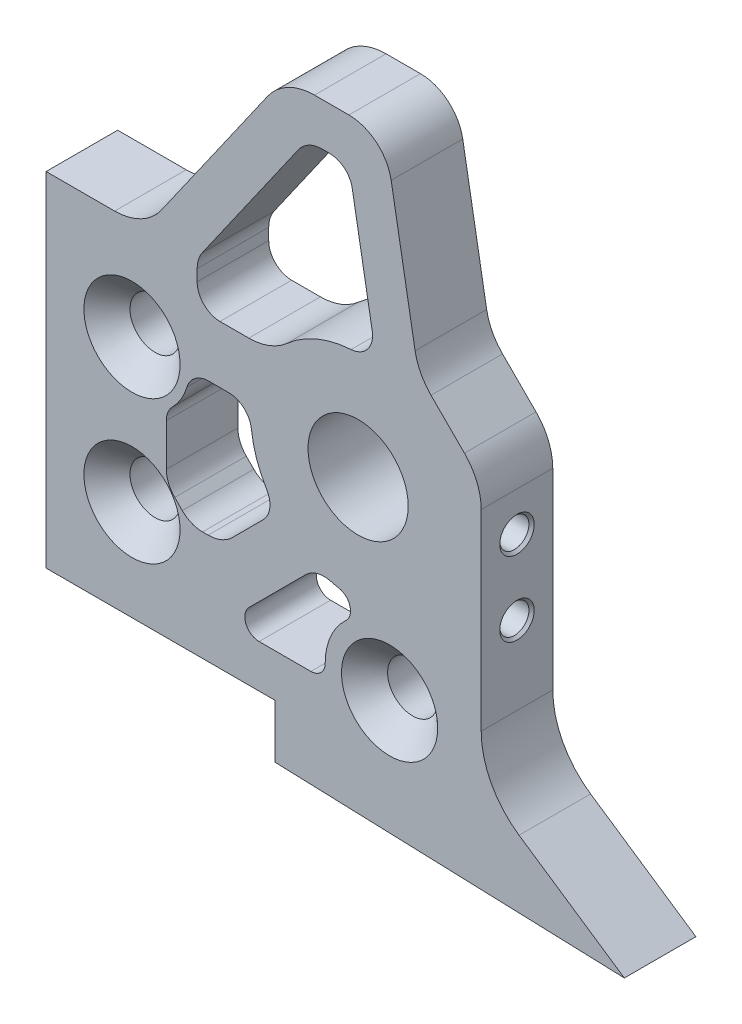
from build123d import *

# Parameters (mm, degrees)
ESBO_O1_R                                           = 17.5
RESSALTO_EXTRUS_O1_DEPTH                            = 25
FILETE1_R                                           = 20
FILETE3_R                                           = 15
CORTE_EXTRUS_O1_DEPTH                               = 156.467038307
ESCAREADO_PARA_PARAFUSO_ALLEN_SEXTAVADO_D           = 17.5
ESCAREADO_PARA_PARAFUSO_ALLEN_SEXTAVADO_CSINK_D     = 33.6
ESCAREADO_PARA_PARAFUSO_ALLEN_SEXTAVADO_CSINK_ANGLE = 90
FURO_ROSCADO_DE_M121_D                              = 10.2
FURO_ROSCADO_DE_M121_DEPTH                          = 25
FURO_ROSCADO_DE_M121_CSINK_D                        = 12.05
FURO_ROSCADO_DE_M121_CSINK_ANGLE                    = 90
FURO_ROSCADO_DE_M121_TIP                            = 3.064389157
FURO_ROSCADO_DE_M122_D                              = 10.2
FURO_ROSCADO_DE_M122_DEPTH                          = 20
FURO_ROSCADO_DE_M122_CSINK_D                        = 12.05
FURO_ROSCADO_DE_M122_CSINK_ANGLE                    = 90
FURO_ROSCADO_DE_M122_TIP                            = 3.064389157
FILETE12_R                                          = 30


with BuildPart() as part:
    # Esboço1 → Ressalto-extrusão1 (new body)
    with BuildSketch(Plane.XY):
        Polygon((-109, 38), (-109, -82), (-29, -82), (-29, -100.739666122), (93, -105), (43, -71.274574158), (43, 20), (21, 42), (9.362419273, 108), (-25.637580727, 108), (-74.652108401, 38), align=None)
        Circle(ESBO_O1_R, mode=Mode.SUBTRACT)
    extrude(amount=RESSALTO_EXTRUS_O1_DEPTH)

    # Filete1
    filete1_edges = [part.edges().sort_by_distance(p)[0] for p in [
        (21, 42, 12.5),
        (43, 20, 12.5),
        (-74.652108401, 38, 12.5),
        (-25.637580727, 108, 12.5),
    ]]
    fillet(filete1_edges, radius=FILETE1_R)

    # Filete3
    filete3_edges = [part.edges().sort_by_distance(p)[0] for p in [
        (9.362419273, 108, 12.5),
    ]]
    fillet(filete3_edges, radius=FILETE3_R)

    # Esboço2 → Corte-extrusão1 (cut, through all)
    with BuildSketch(Plane.XY.offset(25)):
        with BuildLine():
            Line((-20.814924906, 88.735764364), (-54.42488674, 40.735764364))
            ThreePointArc((-54.42488674, 40.735764364), (-55.770535805, 38.007057995), (-56.233366297, 35))
            Line((-56.233366297, 35), (-56.233366297, 31))
            ThreePointArc((-56.233366297, 31), (-53.890220547, 25.343145751), (-48.233366297, 23))
            Line((-48.233366297, 23), (-38.173943993, 23))
            ThreePointArc((-38.173943993, 23), (-31.072198954, 24.303336731), (-24.89605043, 28.043478261))
            ThreePointArc((-24.89605043, 28.043478261), (-14.44771543, 34.605108277), (-2.435454992, 37.420830549))
            ThreePointArc((-2.435454992, 37.420830549), (3.337174211, 40.463464565), (4.9234433, 46.793126488))
            Line((4.9234433, 46.793126488), (-2.05841022, 86.389185421))
            ThreePointArc((-2.05841022, 86.389185421), (-4.794571366, 91.128355545), (-9.936872244, 93))
            Line((-9.936872244, 93), (-12.623404463, 93))
            ThreePointArc((-12.623404463, 93), (-17.240890595, 91.870108332), (-20.814924906, 88.735764364))
        make_face()
        with BuildLine():
            Line((-52.16718427, 3), (-45.224440295, 3))
            ThreePointArc((-45.224440295, 3), (-39.887445215, 0.959570749), (-37.272890353, -4.120879121))
            ThreePointArc((-37.272890353, -4.120879121), (-35.47802498, -12.147417153), (-31.976509443, -19.589610609))
            ThreePointArc((-31.976509443, -19.589610609), (-30.853677224, -24.709534266), (-33.141310542, -29.425581789))
            Line((-33.141310542, -29.425581789), (-43.916738879, -40.201010127))
            ThreePointArc((-43.916738879, -40.201010127), (-47.809819065, -42.802283143), (-52.402020254, -43.715728753))
            Line((-52.402020254, -43.715728753), (-54.357864376, -43.715728753))
            ThreePointArc((-54.357864376, -43.715728753), (-58.1846987, -42.954524078), (-61.428932188, -40.786796564))
            Line((-61.428932188, -40.786796564), (-64.071067812, -38.144660941))
            ThreePointArc((-64.071067812, -38.144660941), (-66.238795325, -34.900427452), (-67, -31.073593129))
            Line((-67, -31.073593129), (-67, -16.370637166))
            ThreePointArc((-67, -16.370637166), (-66.435760282, -13.526287035), (-64.828493161, -11.112703282))
            ThreePointArc((-64.828493161, -11.112703282), (-61.810304111, -7.223226263), (-59.83370305, -2.714285714))
            ThreePointArc((-59.83370305, -2.714285714), (-56.948098707, 1.414269806), (-52.16718427, 3))
        make_face()
        with BuildLine():
            Line((-18.262146843, -38.588048651), (-38.138564286, -58.464466094))
            ThreePointArc((-38.138564286, -58.464466094), (-39.222428043, -63.913417162), (-34.60303038, -67))
            Line((-34.60303038, -67), (-16.5, -67))
            ThreePointArc((-16.5, -67), (-12.964466094, -65.535533906), (-11.5, -62))
            ThreePointArc((-11.5, -62), (-9.613540035, -52.981576235), (-4.270491803, -45.475409836))
            ThreePointArc((-4.270491803, -45.475409836), (-2.861886802, -40.410318309), (-6.762295082, -36.885245902))
            ThreePointArc((-6.762295082, -36.885245902), (-8.184936807, -36.595857818), (-9.595311139, -36.251620711))
            ThreePointArc((-9.595311139, -36.251620711), (-14.240797491, -36.262235776), (-18.262146843, -38.588048651))
        make_face()
    extrude(amount=-CORTE_EXTRUS_O1_DEPTH, mode=Mode.SUBTRACT)

    # Escareado para parafuso Allen sextavado (through all)
    with Locations(Plane(origin=(-79, 3, 25), x_dir=(1, 0, 0), z_dir=(0, 0, 1))):
        with Locations((0, 0), (0, -50), (90, -65)):
            CounterSinkHole(ESCAREADO_PARA_PARAFUSO_ALLEN_SEXTAVADO_D / 2, ESCAREADO_PARA_PARAFUSO_ALLEN_SEXTAVADO_CSINK_D / 2, counter_sink_angle=ESCAREADO_PARA_PARAFUSO_ALLEN_SEXTAVADO_CSINK_ANGLE)

    # Furo roscado de M121
    with Locations(Plane.ZY.offset(109)):
        with Locations((12.5, 20), (12.5, -22), (12.5, -64)):
            CounterSinkHole(FURO_ROSCADO_DE_M121_D / 2, FURO_ROSCADO_DE_M121_CSINK_D / 2, depth=FURO_ROSCADO_DE_M121_DEPTH, counter_sink_angle=FURO_ROSCADO_DE_M121_CSINK_ANGLE)
            with Locations((0, 0, -(FURO_ROSCADO_DE_M121_DEPTH + FURO_ROSCADO_DE_M121_TIP / 2))):  # 118° drill point
                Cone(0, FURO_ROSCADO_DE_M121_D / 2, FURO_ROSCADO_DE_M121_TIP, mode=Mode.SUBTRACT)

    # Furo roscado de M122
    with Locations(Plane(origin=(43, 0, 0), x_dir=(0, 0, -1), z_dir=(1, 0, 0))):
        with Locations((-12.5, -2), (-12.5, -28)):
            CounterSinkHole(FURO_ROSCADO_DE_M122_D / 2, FURO_ROSCADO_DE_M122_CSINK_D / 2, depth=FURO_ROSCADO_DE_M122_DEPTH, counter_sink_angle=FURO_ROSCADO_DE_M122_CSINK_ANGLE)
            with Locations((0, 0, -(FURO_ROSCADO_DE_M122_DEPTH + FURO_ROSCADO_DE_M122_TIP / 2))):  # 118° drill point
                Cone(0, FURO_ROSCADO_DE_M122_D / 2, FURO_ROSCADO_DE_M122_TIP, mode=Mode.SUBTRACT)

    # Filete12
    filete12_edges = [part.edges().sort_by_distance(p)[0] for p in [
        (43, -71.274574158, 12.5),
    ]]
    fillet(filete12_edges, radius=FILETE12_R)


solid = part.part
